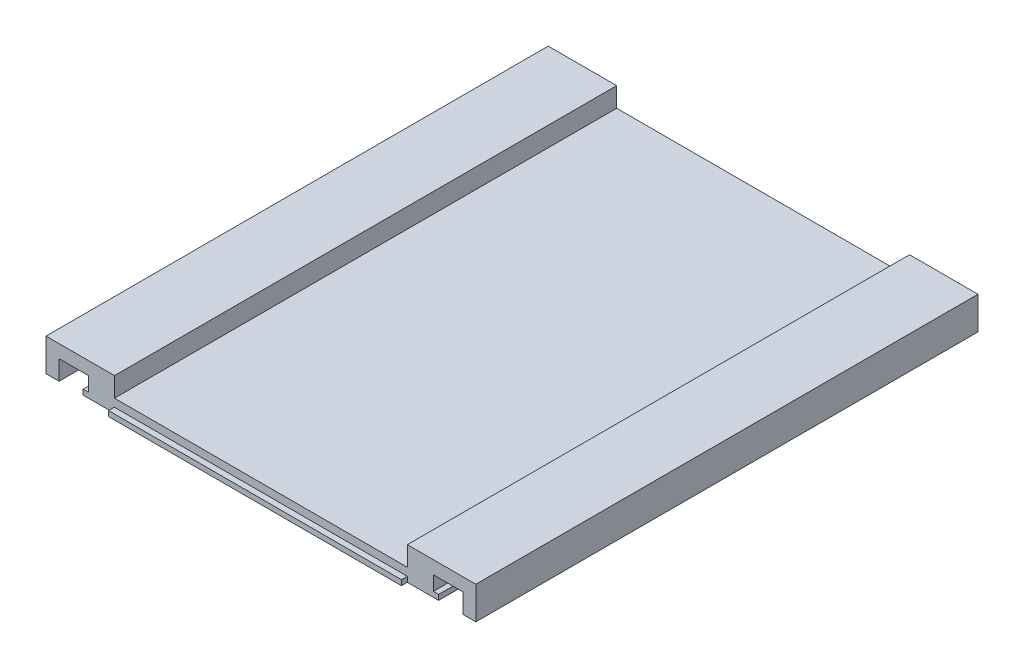
from build123d import *

# Parameters (mm, degrees)
SKETCH_1_W          = 52.9
SKETCH_1_H          = 77
EXTRUDE_1_DEPTH     = 2
SKETCH_1_3_W        = 0.8
SKETCH_1_3_H        = 77
EXTRUDE_2_DEPTH     = 0.8
SKETCH_2_W          = 54.5
SKETCH_2_H          = 0.9
EXTRUDE_3_DEPTH     = 0.8
SKETCH_3_W          = 4.8
SKETCH_3_H          = 0.9
CUT_EXTRUDE_1_DEPTH = 0.8
EXTRUDE_START       = -38.5
EXTRUDE_4_DEPTH     = 77


with BuildPart() as part:
    # 草图1 → 凸台-拉伸1 (new body)
    with BuildSketch(Plane(origin=(0, 0, 0), x_dir=(1, 0, 0), z_dir=(0, 1, 0))):
        Rectangle(SKETCH_1_W, SKETCH_1_H)
    extrude(amount=EXTRUDE_1_DEPTH)

    # 草图1<3> → 凸台-拉伸2 (add)
    with BuildSketch(Plane(origin=(0, 0, 0), x_dir=(1, 0, 0), z_dir=(0, 1, 0))):
        with Locations((26.85, 0)):
            Rectangle(SKETCH_1_3_W, SKETCH_1_3_H)
        with Locations((-26.85, 0)):
            Rectangle(SKETCH_1_3_W, SKETCH_1_3_H)
    extrude(amount=EXTRUDE_2_DEPTH)

    # 草图2 → 凸台-拉伸3 (add)
    with BuildSketch(Plane(origin=(0, 0, 0), x_dir=(1, 0, 0), z_dir=(0, 1, 0))):
        with Locations((0, -38.95)):
            Rectangle(SKETCH_2_W, SKETCH_2_H)
    extrude(amount=EXTRUDE_3_DEPTH)

    # 草图3 → 切除-拉伸1 (cut)
    with BuildSketch(Plane(origin=(0, 0, 0), x_dir=(1, 0, 0), z_dir=(0, 1, 0))):
        with Locations((-24.85, -38.95)):
            Rectangle(SKETCH_3_W, SKETCH_3_H)
        with Locations((24.85, -38.95)):
            Rectangle(SKETCH_3_W, SKETCH_3_H)
    extrude(amount=CUT_EXTRUDE_1_DEPTH, mode=Mode.SUBTRACT)

    # 草图4 → 凸台-拉伸4 (add)
    with BuildSketch(Plane.XY.offset(EXTRUDE_START)):
        Polygon((22.45, 3), (22.45, 5), (32.95, 5), (32.95, 0), (30.95, 0), (30.95, 3), (26.45, 3), (26.45, 2), (22.45, 2), align=None)
        Polygon((-30.95, 0), (-30.95, 3), (-26.45, 3), (-26.45, 2), (-22.45, 2), (-22.45, 3), (-22.45, 5), (-32.95, 5), (-32.95, 0), align=None)
    extrude(amount=EXTRUDE_4_DEPTH)


solid = part.part
